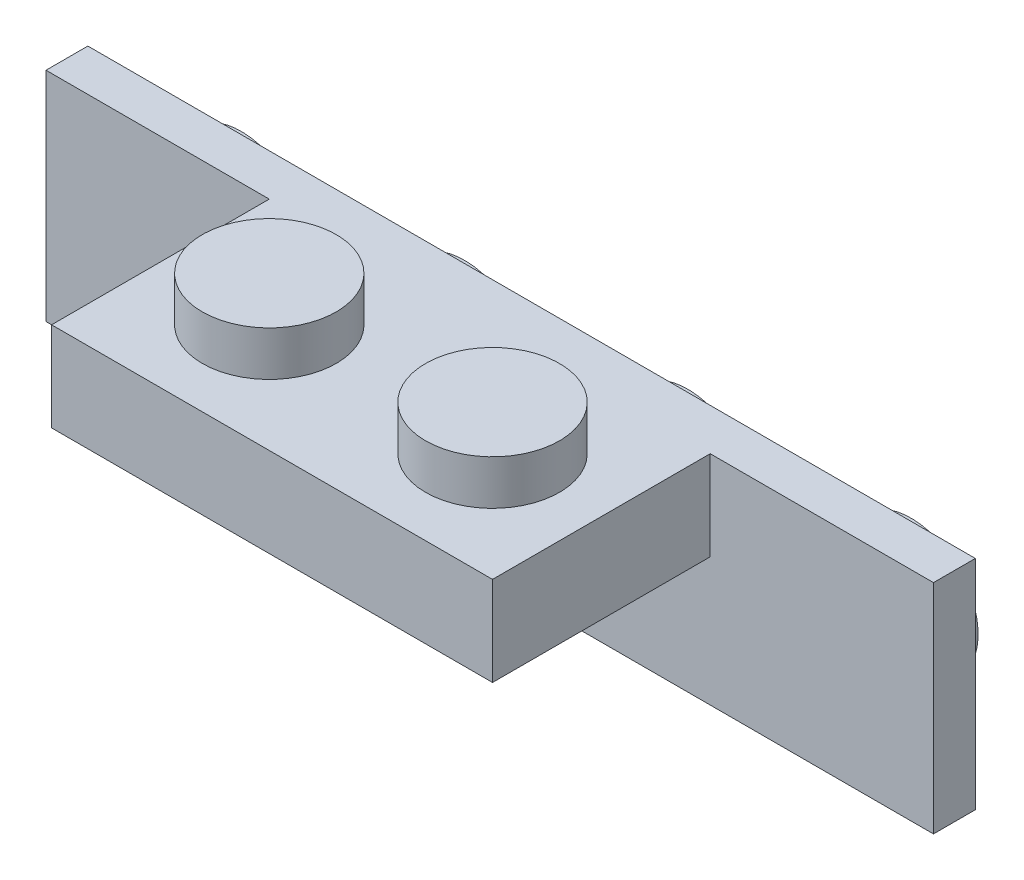
from build123d import *

# Parameters (mm, degrees)
SKETCH1_W            = 15.8
SKETCH1_H            = 3.2
BOSS_EXTRUDE1_DEPTH  = 7.8
SKETCH2_R            = 2.4
BOSS_EXTRUDE2_DEPTH  = 1.6
LPATTERN1_COUNT      = 2
LPATTERN1_PITCH      = 8
LPATTERN1_COUNT_DIR2 = 6
LPATTERN1_PITCH_DIR2 = 8
SHELL1_T             = -1.2
SKETCH3_R            = 1.5
SKETCH3_R_2          = 0.6
BOSS_EXTRUDE3_DEPTH  = 1.8
BOSS_EXTRUDE4_DEPTH  = 1.5
SKETCH5_R            = 2.4
SKETCH5_R_2          = 1.55
BOSS_EXTRUDE5_DEPTH  = 1.6
LPATTERN2_COUNT      = 4
LPATTERN2_PITCH      = 8


with BuildPart() as part:
    # Sketch1 → Boss-Extrude1 (new body)
    with BuildSketch(Plane.XY):
        with Locations((7.9, 1.6)):
            Rectangle(SKETCH1_W, SKETCH1_H)
    extrude(amount=-BOSS_EXTRUDE1_DEPTH)

    # Sketch2 → Boss-Extrude2 (add)
    with BuildSketch(Plane(origin=(0, 3.2, 0), x_dir=(1, 0, 0), z_dir=(0, 1, 0))):
        with Locations(Location((3.9, 3.9, 0), (0, 0, 270))):
            Circle(SKETCH2_R)
    boss_extrude2 = extrude(amount=BOSS_EXTRUDE2_DEPTH)

    # LPattern1: Boss-Extrude2 2 × 6, 10 skipped
    with Locations(*[(j * LPATTERN1_PITCH_DIR2, 0, i * LPATTERN1_PITCH) for i in range(LPATTERN1_COUNT) for j in range(LPATTERN1_COUNT_DIR2) if (i, j) not in ((0, 0), (0, 2), (0, 3), (0, 4), (0, 5), (1, 0), (1, 1), (1, 2), (1, 3), (1, 4), (1, 5))]):
        add(boss_extrude2)

    # Shell1
    shell1_openings = [part.faces().sort_by_distance(p)[0] for p in [
        (7.9, 0, -3.9),
    ]]
    offset(amount=SHELL1_T, openings=shell1_openings, kind=Kind.INTERSECTION)

    # Sketch3 → Boss-Extrude3 (add)
    with BuildSketch(Plane.XZ.offset(-2)):
        with Locations(Location((7.9, -3.9, 0), (0, 0, 90))):
            Circle(SKETCH3_R)
        with Locations(Location((7.9, -3.9, 0), (0, 0, 270))):
            Circle(SKETCH3_R_2, mode=Mode.SUBTRACT)
    extrude(amount=BOSS_EXTRUDE3_DEPTH)

    # Sketch4 → Boss-Extrude4 (add)
    with BuildSketch(Plane(origin=(0, 0, -7.8), x_dir=(-1, 0, 0), z_dir=(0, 0, -1))):
        Polygon((-15.8, 3.2), (-23.8, 3.2), (-23.8, -4.6), (8, -4.6), (8, 3.2), (0, 3.2), align=None)
    extrude(amount=BOSS_EXTRUDE4_DEPTH)

    # Sketch5 → Boss-Extrude5 (add)
    with BuildSketch(Plane(origin=(0, 0, -9.3), x_dir=(-1, 0, 0), z_dir=(0, 0, -1))):
        with Locations((4.1, -0.7)):
            Circle(SKETCH5_R)
        with Locations((4.1, -0.7)):
            Circle(SKETCH5_R_2, mode=Mode.SUBTRACT)
    boss_extrude5 = extrude(amount=BOSS_EXTRUDE5_DEPTH)

    # LPattern2: Boss-Extrude5 ×4
    with Locations(*[(i * LPATTERN2_PITCH, 0, 0) for i in range(1, LPATTERN2_COUNT)]):
        add(boss_extrude5)


solid = part.part
